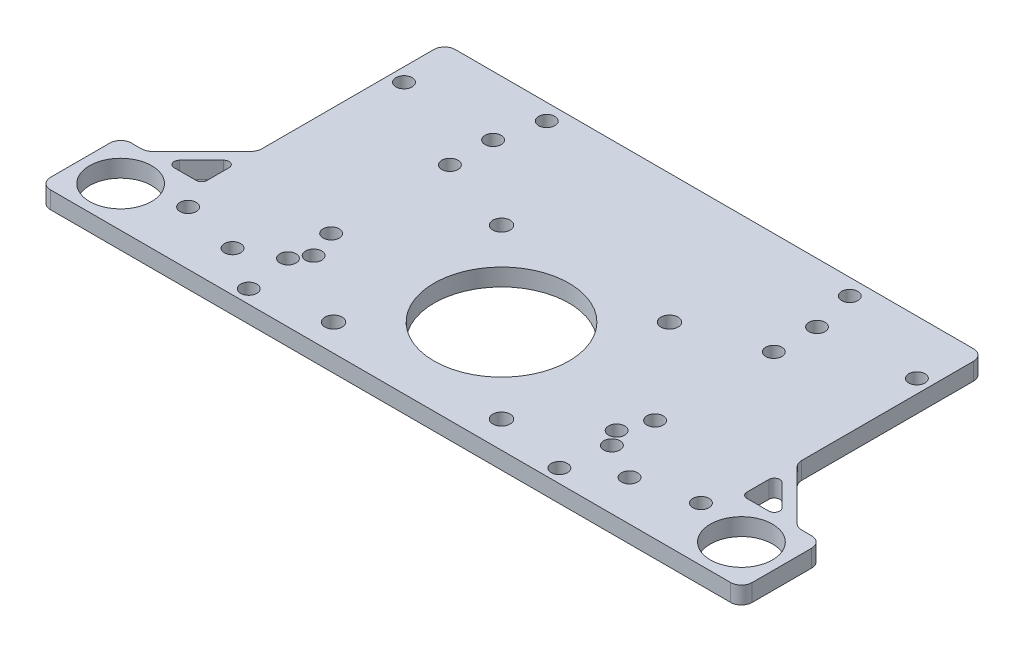
from build123d import *

# Parameters (mm, degrees)
SKETCH_1_W          = 100
SKETCH_1_H          = 60
EXTRUDE_1_DEPTH     = 3.2
SKETCH_2_R          = 12.5
SKETCH_2_R_2        = 1.6
SKETCH_2_R_3        = 1.5
SKETCH_2_R_4        = 5.75
CUT_EXTRUDE_1_DEPTH = 3.2
FILLET_1_R          = 2
FILLET_2_R          = 1


with BuildPart() as part:
    # 草图1 → 凸台-拉伸1 (new body)
    with BuildSketch(Plane(origin=(0, 0, 0), x_dir=(1, 0, 0), z_dir=(0, 1, 0))):
        Polygon((-57.5, -15), (-60.328427125, -15), (-65, -15), (-65, -30), (-50, -30), (-50, -15), align=None)
        Rectangle(SKETCH_1_W, SKETCH_1_H)
        Polygon((-50, -7.5), (-50, -4.671572875), (-60.328427125, -15), (-57.5, -15), align=None)
        Polygon((65, -15), (60.328427125, -15), (57.5, -15), (50, -15), (50, -30), (65, -30), align=None)
        Polygon((60.328427125, -15), (50, -4.671572875), (50, -7.5), (57.5, -15), align=None)
    extrude(amount=EXTRUDE_1_DEPTH)

    # 草图2 → 切除-拉伸1 (cut)
    with BuildSketch(Plane(origin=(0, 3.2, 0), x_dir=(1, 0, 0), z_dir=(0, 1, 0))):
        with Locations(Location((0, -9.443650814, 0), (0, 0, 270))):
            Circle(SKETCH_2_R)
        with Locations(Location((15.556349186, -25, 0), (0, 0, 270))):
            Circle(SKETCH_2_R_2)
        with Locations(Location((15.556349186, 6.112698372, 0), (0, 0, 270))):
            Circle(SKETCH_2_R_2)
        with Locations(Location((-15.556349186, 6.112698372, 0), (0, 0, 270))):
            Circle(SKETCH_2_R_2)
        with Locations(Location((-15.556349186, -25, 0), (0, 0, 270))):
            Circle(SKETCH_2_R_2)
        with Locations(Location((-47.5, 20, 0), (0, 0, 270))):
            Circle(SKETCH_2_R_3)
        with Locations(Location((-47.5, -20, 0), (0, 0, 270))):
            Circle(SKETCH_2_R_3)
        with Locations(Location((47.5, -20, 0), (0, 0, 270))):
            Circle(SKETCH_2_R_3)
        with Locations(Location((47.5, 20, 0), (0, 0, 270))):
            Circle(SKETCH_2_R_3)
        with Locations(Location((-57.5, -22.5, 0), (0, 0, 270))):
            Circle(SKETCH_2_R_4)
        with Locations(Location((57.5, -22.5, 0), (0, 0, 270))):
            Circle(SKETCH_2_R_4)
        with Locations(Location((30, 19, 0), (0, 0, 270))):
            Circle(SKETCH_2_R_3)
        with Locations(Location((30, 11, 0), (0, 0, 270))):
            Circle(SKETCH_2_R_3)
        with Locations(Location((-30, 11, 0), (0, 0, 270))):
            Circle(SKETCH_2_R_3)
        with Locations(Location((-30, 19, 0), (0, 0, 270))):
            Circle(SKETCH_2_R_3)
        with Locations(Location((30, -11, 0), (0, 0, 270))):
            Circle(SKETCH_2_R_3)
        with Locations(Location((30, -19, 0), (0, 0, 270))):
            Circle(SKETCH_2_R_3)
        with Locations(Location((-30, -19, 0), (0, 0, 270))):
            Circle(SKETCH_2_R_3)
        with Locations(Location((-30, -11, 0), (0, 0, 270))):
            Circle(SKETCH_2_R_3)
        with Locations(Location((-28.065, 27, 0), (0, 0, 270))):
            Circle(SKETCH_2_R_3)
        with Locations(Location((28.065, 27, 0), (0, 0, 270))):
            Circle(SKETCH_2_R_3)
        with Locations(Location((-28.065, -16.18, 0), (0, 0, 270))):
            Circle(SKETCH_2_R_3)
        with Locations(Location((28.065, -16.18, 0), (0, 0, 270))):
            Circle(SKETCH_2_R_3)
        with Locations(Location((-28.769, -27.5, 0), (0, 0, 270))):
            Circle(SKETCH_2_R_3)
        with Locations(Location((28.769, -27.5, 0), (0, 0, 270))):
            Circle(SKETCH_2_R_3)
        with Locations(Location((-36.769, -22.5, 0), (0, 0, 270))):
            Circle(SKETCH_2_R_3)
        with Locations(Location((36.769, -22.5, 0), (0, 0, 270))):
            Circle(SKETCH_2_R_3)
    extrude(amount=-CUT_EXTRUDE_1_DEPTH, mode=Mode.SUBTRACT)

    # 圆角1
    fillet_1_edges = [part.edges().sort_by_distance(p)[0] for p in [
        (-60.328427125, 1.6, 15),
        (-50, 1.6, 4.671572875),
        (-50, 1.6, -30),
        (50, 1.6, -30),
        (50, 1.6, 4.671572875),
        (60.328427125, 1.6, 15),
        (65, 1.6, 15),
        (65, 1.6, 30),
        (-65, 1.6, 30),
        (-65, 1.6, 15),
    ]]
    fillet(fillet_1_edges, radius=FILLET_1_R)

    # 圆角2
    fillet_2_edges = [part.edges().sort_by_distance(p)[0] for p in [
        (-57.5, 1.6, 15),
        (-50, 1.6, 15),
        (-50, 1.6, 7.5),
        (50, 1.6, 7.5),
        (50, 1.6, 15),
        (57.5, 1.6, 15),
    ]]
    fillet(fillet_2_edges, radius=FILLET_2_R)


solid = part.part
